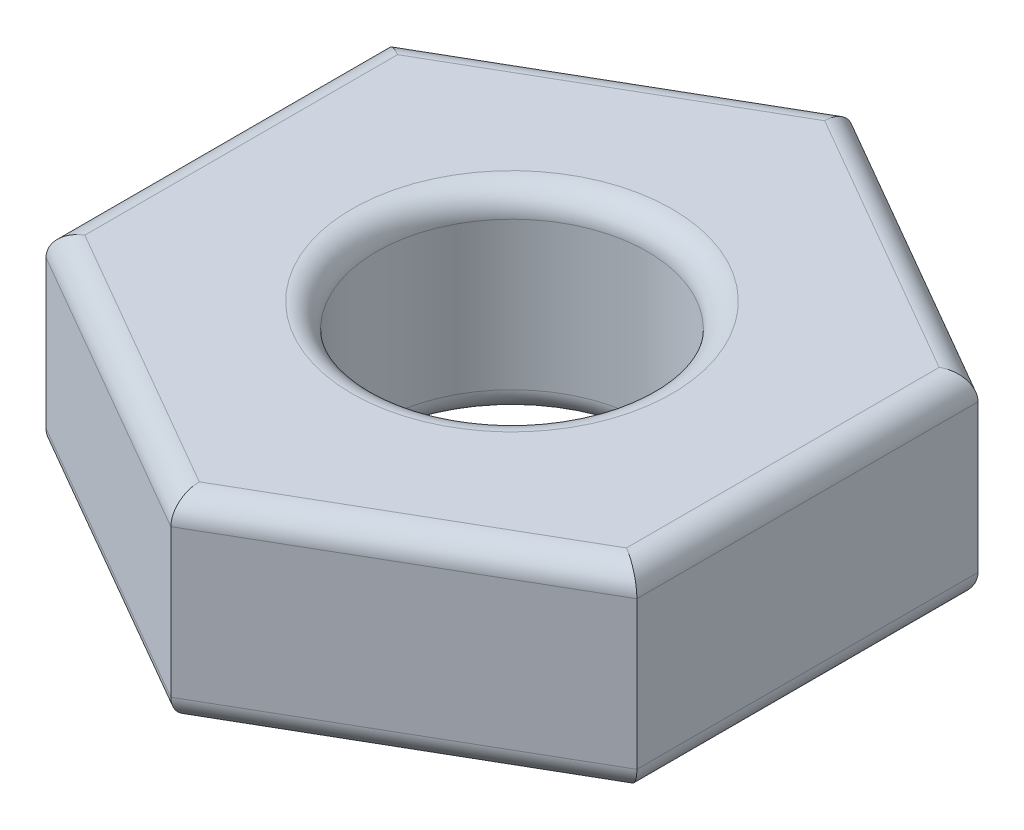
from build123d import *

# Parameters (mm, degrees)
BOSS_EXTRUDE1_DEPTH = 1.6
CUT_EXTRUDE1_REACH  = 6
SKETCH2_R           = 1.1
FILLET1_R           = 0.2


with BuildPart() as part:
    # Sketch1 → Boss-Extrude1 (new body)
    with BuildSketch(Plane(origin=(0, 0, 0), x_dir=(1, 0, 0), z_dir=(0, 1, 0))):
        Polygon((2.4, 1.385640646), (0, 2.771281292), (-2.4, 1.385640646), (-2.4, -1.385640646), (0, -2.771281292), (2.4, -1.385640646), align=None)
    extrude(amount=BOSS_EXTRUDE1_DEPTH)

    # Sketch2 → Cut-Extrude1 (cut, up to next)
    with BuildSketch(Plane(origin=(0, 1.6, 0), x_dir=(1, 0, 0), z_dir=(0, 1, 0)), mode=Mode.PRIVATE) as cut_extrude1_sk1:
        with Locations(Location((0, 0, 0), (0, 0, 270))):
            Circle(SKETCH2_R)
    cut_extrude1_tool1 = extrude(cut_extrude1_sk1.sketch, amount=-CUT_EXTRUDE1_REACH, mode=Mode.PRIVATE) & part.part
    add(cut_extrude1_tool1.solids().sort_by_distance((0, 1.6, 0))[0], mode=Mode.SUBTRACT)

    # Fillet1
    fillet1_edges = [part.edges().sort_by_distance(p)[0] for p in [
        (-1.2, 1.6, -2.078460969),
        (-2.4, 1.6, 0),
        (-1.2, 1.6, 2.078460969),
        (0, 1.6, -1.1),
        (0, 0, -1.1),
        (1.2, 1.6, 2.078460969),
        (2.4, 1.6, 0),
        (1.2, 0, 2.078460969),
        (-1.2, 0, 2.078460969),
        (-2.4, 0, 0),
        (-1.2, 0, -2.078460969),
        (1.2, 0, -2.078460969),
        (2.4, 0, 0),
        (1.2, 1.6, -2.078460969),
    ]]
    fillet(fillet1_edges, radius=FILLET1_R)


solid = part.part
